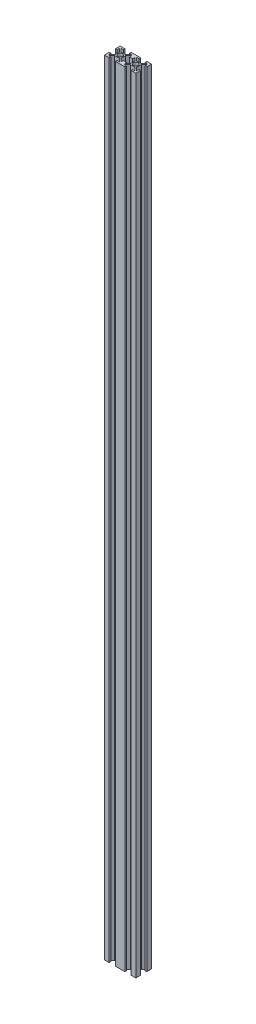
from build123d import *

# Parameters (mm, degrees)
F_2020_SKETCH_R     = 3
BOSS_EXTRUDE1_DEPTH = 1000


with BuildPart() as part:
    # 2020 sketch → Boss-Extrude1 (new body)
    with BuildSketch(Plane(origin=(0, 0, 0), x_dir=(1, 0, 0), z_dir=(0, 1, 0))):
        Polygon((-4, 10), (-4, 8), (-7, 8), (-3, 4), (3, 4), (7, 8), (4, 8), (4, 10), (10, 10), (10, 4), (8, 4), (8, 7), (4, 3), (4, -3), (8, -7), (8, -4), (10, -4), (10, -10), (4, -10), (4, -8), (7, -8), (3, -4), (-3, -4), (-7, -8), (-4, -8), (-4, -10), (-10, -10), (-10, -4), (-8, -4), (-8, -7), (-4, -3), (-4, 3), (-8, 7), (-8, 4), (-10, 4), (-10, 10), align=None)
        with Locations(Location((0, 0, 0), (0, 0, 270))):
            Circle(F_2020_SKETCH_R, mode=Mode.SUBTRACT)
    boss_extrude1 = extrude(amount=BOSS_EXTRUDE1_DEPTH)

    # Mirror1: Boss-Extrude1 across plane
    add(boss_extrude1.mirror(Plane(origin=(10, 1000, 4), x_dir=(0, 0, 1), z_dir=(1, 0, 0))))


solid = part.part
